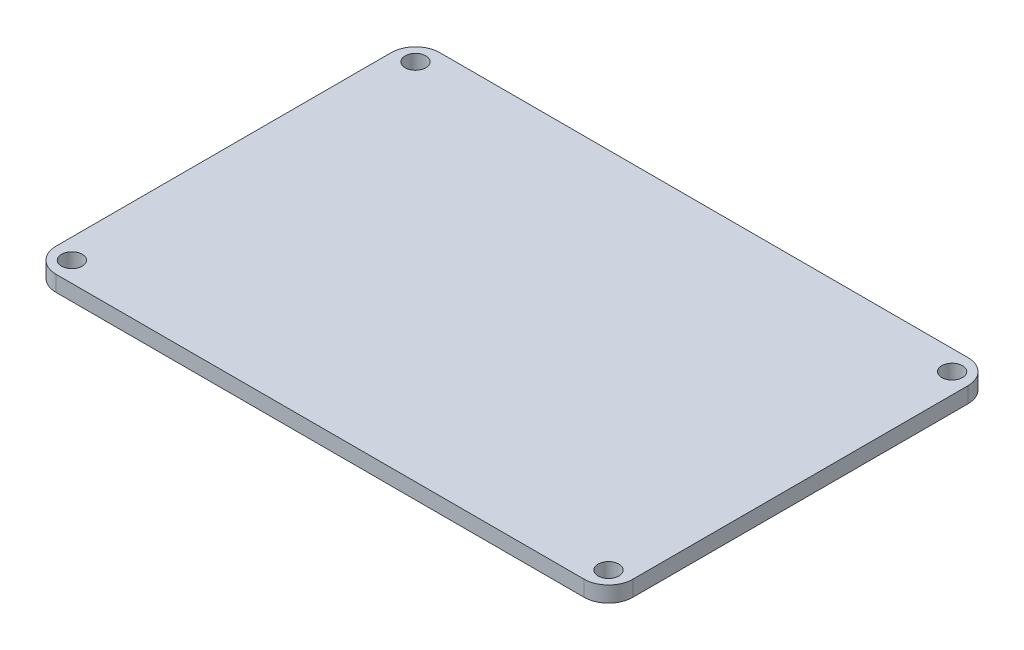
from build123d import *

# Parameters (mm, degrees)
SKETCH1_W               = 60.1218
SKETCH1_H               = 40.005
BOSS_EXTRUDE1_DEPTH     = 1.6383
FILLET1_R               = 2.54
SKETCH3_R               = 1.0795
CUT_EXTRUDE2_DEPTH      = 73.233751717
MIRROR2_COPY_1_SKETCH_R = 1.0795
MIRROR2_COPY_1_DEPTH    = 73.233751717


with BuildPart() as part:
    # Sketch1 → Boss-Extrude1 (new body)
    with BuildSketch(Plane(origin=(0, 0, 0), x_dir=(1, 0, 0), z_dir=(0, 1, 0))):
        with Locations((30.0609, 20.0025)):
            Rectangle(SKETCH1_W, SKETCH1_H)
    extrude(amount=BOSS_EXTRUDE1_DEPTH)

    # Fillet1
    fillet1_edges = [part.edges().sort_by_distance(p)[0] for p in [
        (0, 0.81915, -40.005),
        (60.1218, 0.81915, -40.005),
        (60.1218, 0.81915, 0),
        (0, 0.81915, 0),
    ]]
    fillet(fillet1_edges, radius=FILLET1_R)

    # Sketch3 → Cut-Extrude2 (cut, through all)
    with BuildSketch(Plane(origin=(0, 1.6383, 0), x_dir=(1, 0, 0), z_dir=(0, 1, 0))):
        with Locations(Location((2.0955, 2.0955, 0), (0, 0, 270))):
            Circle(SKETCH3_R)
    cut_extrude2 = extrude(amount=-CUT_EXTRUDE2_DEPTH, mode=Mode.SUBTRACT)

    # Mirror1: Cut-Extrude2 across plane
    add(cut_extrude2.mirror(Plane.XY.offset(-20.0025)), mode=Mode.SUBTRACT)

    # Mirror2: Cut-Extrude2 across plane
    add(cut_extrude2.mirror(Plane(origin=(30.0609, 0, 0), x_dir=(0, 0, 1), z_dir=(1, 0, 0))), mode=Mode.SUBTRACT)

    # Mirror2 copy 1 sketch → Mirror2 copy 1 (cut, through all)
    with BuildSketch(Plane(origin=(60.1218, 1.6383, -40.005), x_dir=(-1, 0, 0), z_dir=(0, 1, 0))):
        with Locations(Location((2.0955, 2.0955, 0), (0, 0, 270))):
            Circle(MIRROR2_COPY_1_SKETCH_R)
    extrude(amount=-MIRROR2_COPY_1_DEPTH, mode=Mode.SUBTRACT)


solid = part.part
